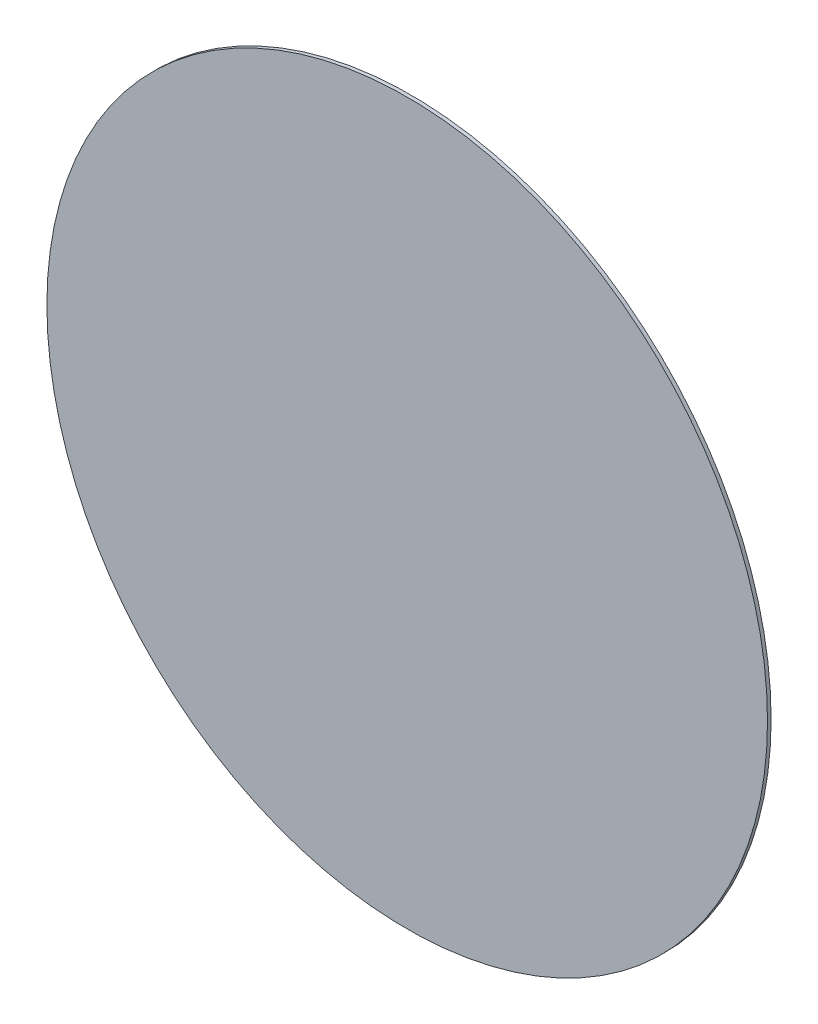
from build123d import *

# Parameters (mm, degrees)
SKETCH1_R           = 6.35
BOSS_EXTRUDE1_DEPTH = 0.0635


with BuildPart() as part:
    # Sketch1 → Boss-Extrude1 (new body)
    with BuildSketch(Plane.XY):
        Circle(SKETCH1_R)
    extrude(amount=BOSS_EXTRUDE1_DEPTH)


solid = part.part
